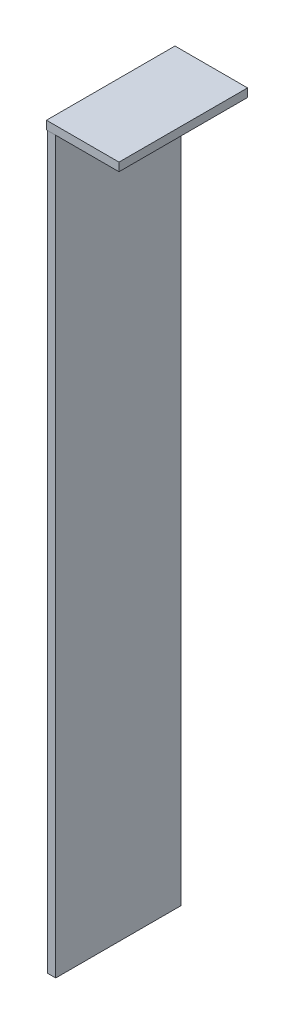
from build123d import *

# Parameters (mm, degrees)
SKETCH1_W           = 30
SKETCH1_H           = 175
BOSS_EXTRUDE1_DEPTH = 2
SKETCH2_W           = 17.389654657
SKETCH2_H           = 30.808247404
BOSS_EXTRUDE3_DEPTH = 2


with BuildPart() as part:
    # Sketch1 → Boss-Extrude1 (new body)
    with BuildSketch(Plane(origin=(0, 0, 0), x_dir=(0, 0, -1), z_dir=(1, 0, 0))):
        with Locations((3.238527887, -36.639862439)):
            Rectangle(SKETCH1_W, SKETCH1_H)
    extrude(amount=BOSS_EXTRUDE1_DEPTH)

    # Sketch2 → Boss-Extrude3 (add)
    with BuildSketch(Plane(origin=(0, 50.860137561, 0), x_dir=(1, 0, 0), z_dir=(0, 1, 0))):
        with Locations((8.532246384, 3.578274216)):
            Rectangle(SKETCH2_W, SKETCH2_H)
    extrude(amount=BOSS_EXTRUDE3_DEPTH)


solid = part.part
